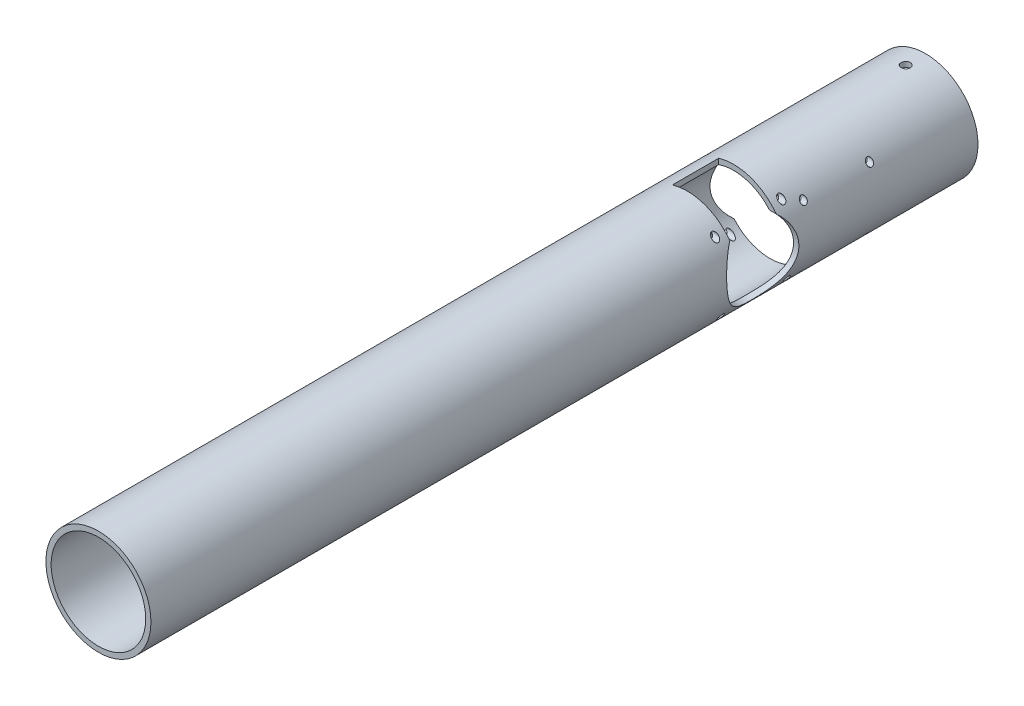
from build123d import *

# Parameters (mm, degrees)
BOSS_EXTRUDE1_DEPTH      = 250
BOSS_EXTRUDE1_DEPTH_BACK = 250
SKETCH1_R                = 31.75
SKETCH1_R_2              = 28.575
SKETCH2_R                = 21.75
CUT_EXTRUDE1_DEPTH       = 255.000246063
SKETCH3_R                = 21.75
CUT_EXTRUDE2_DEPTH       = 255.000246186
CUT_EXTRUDE4_START       = 9
SKETCH5_W                = 28
SKETCH5_H                = 22
CUT_EXTRUDE4_DEPTH       = 264.000246186
CUT_EXTRUDE5_START       = -9
SKETCH6_W                = 28
SKETCH6_H                = 22
CUT_EXTRUDE5_DEPTH       = 264.000246186
CUT_EXTRUDE7_DEPTH       = 255.000246186
CUT_EXTRUDE7_DEPTH_BACK  = 255.000246186
SKETCH9_R                = 2
CUT_EXTRUDE8_DEPTH       = 255.000246186
CUT_EXTRUDE8_DEPTH_BACK  = 255.000246186
SKETCH11_R               = 2
SKETCH12_R               = 2.75
CUT_EXTRUDE9_DEPTH       = 260.885191131


with BuildPart() as part:
    # Sketch1 → Boss-Extrude1 (new, two sides: drawn at the far end of the back side and taken through both)
    with BuildSketch(Plane.XY.offset(-BOSS_EXTRUDE1_DEPTH_BACK)):
        Circle(SKETCH1_R)
        Circle(SKETCH1_R_2, mode=Mode.SUBTRACT)
    extrude(amount=BOSS_EXTRUDE1_DEPTH + BOSS_EXTRUDE1_DEPTH_BACK)

    # Sketch2 → Cut-Extrude1 (cut, through all)
    with BuildSketch(Plane(origin=(0, 0, 0), x_dir=(0, 0, -1), z_dir=(1, 0, 0))):
        with Locations((170, -2)):
            Circle(SKETCH2_R)
    extrude(amount=-CUT_EXTRUDE1_DEPTH, mode=Mode.SUBTRACT)

    # Sketch3 → Cut-Extrude2 (cut, through all)
    with BuildSketch(Plane(origin=(0, 0, 0), x_dir=(0, 0, -1), z_dir=(1, 0, 0))):
        with Locations((120, 2)):
            Circle(SKETCH3_R)
    extrude(amount=CUT_EXTRUDE2_DEPTH, mode=Mode.SUBTRACT)

    # Sketch5 → Cut-Extrude4 (cut, through all)
    with BuildSketch(Plane(origin=(0, 0, 0), x_dir=(0, 0, -1), z_dir=(1, 0, 0)).offset(CUT_EXTRUDE4_START)):
        with Locations((170, -23.75)):
            Rectangle(SKETCH5_W, SKETCH5_H)
    extrude(amount=-CUT_EXTRUDE4_DEPTH, mode=Mode.SUBTRACT)

    # Sketch6 → Cut-Extrude5 (cut, through all)
    with BuildSketch(Plane(origin=(0, 0, 0), x_dir=(0, 0, -1), z_dir=(1, 0, 0)).offset(CUT_EXTRUDE5_START)):
        with Locations((120, 23.75)):
            Rectangle(SKETCH6_W, SKETCH6_H)
    extrude(amount=CUT_EXTRUDE5_DEPTH, mode=Mode.SUBTRACT)

    # Sketch9 → Cut-Extrude7 (cut, two sides: drawn at the far end of the back side and taken through both)
    with BuildSketch(Plane(origin=(0, 0, 0), x_dir=(0, 0, -1), z_dir=(1, 0, 0)).offset(-CUT_EXTRUDE7_DEPTH_BACK)):
        with Locations((100, 22)):
            Circle(SKETCH9_R)
        with Locations((140, 22)):
            Circle(SKETCH9_R)
        with Locations((140, -18)):
            Circle(SKETCH9_R)
        with Locations((100, -18)):
            Circle(SKETCH9_R)
    extrude(amount=CUT_EXTRUDE7_DEPTH + CUT_EXTRUDE7_DEPTH_BACK, mode=Mode.SUBTRACT)

    # Sketch11 → Cut-Extrude8 (cut, two sides: drawn at the far end of the back side and taken through both)
    with BuildSketch(Plane(origin=(0, 0, 0), x_dir=(0, 0, -1), z_dir=(1, 0, 0)).offset(-CUT_EXTRUDE8_DEPTH_BACK)):
        with Locations((190, 18)):
            Circle(SKETCH11_R)
        with Locations((150, 18)):
            Circle(SKETCH11_R)
        with Locations((150, -22)):
            Circle(SKETCH11_R)
        with Locations((190, -22)):
            Circle(SKETCH11_R)
    extrude(amount=CUT_EXTRUDE8_DEPTH + CUT_EXTRUDE8_DEPTH_BACK, mode=Mode.SUBTRACT)

    # Sketch12 → Cut-Extrude9 (cut, through all)
    with BuildSketch(Plane(origin=(0, 31.75, 0), x_dir=(1, 0, 0), z_dir=(0, 1, 0))):
        with Locations((0, 238)):
            Circle(SKETCH12_R)
    extrude(amount=-CUT_EXTRUDE9_DEPTH, mode=Mode.SUBTRACT)


solid = part.part
